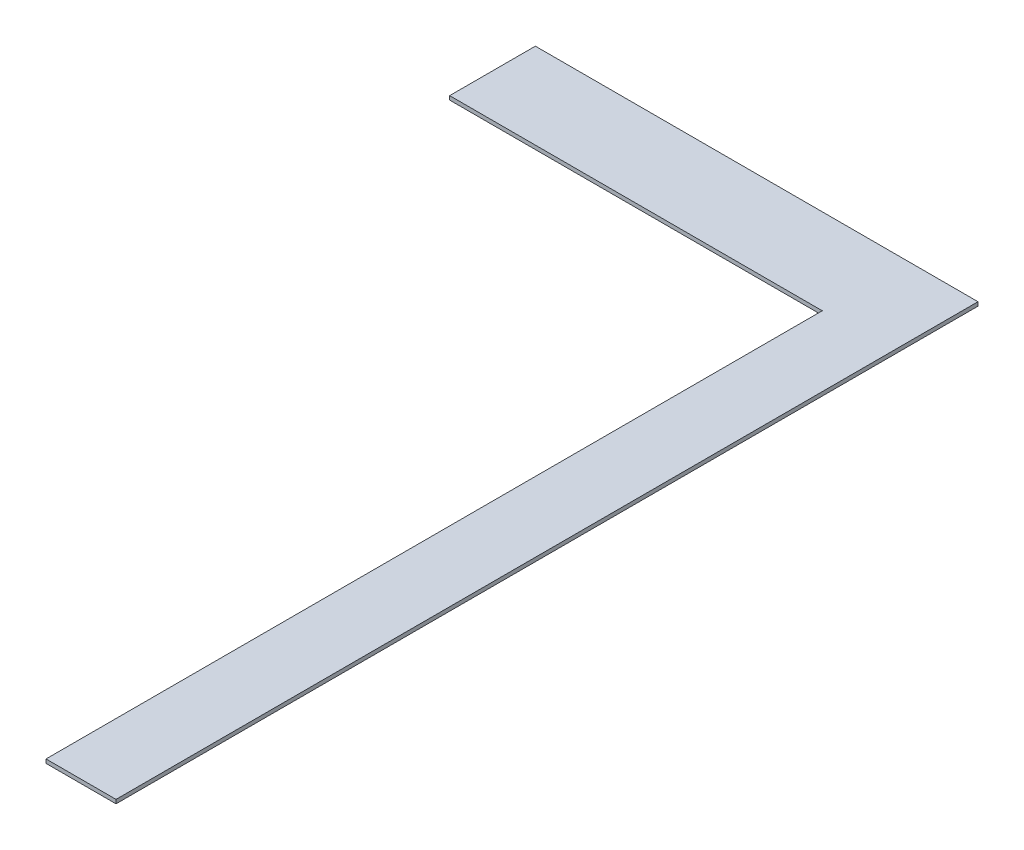
from build123d import *

# Parameters (mm, degrees)
EXTRUDE_1_DEPTH = 12.5


with BuildPart() as part:
    # Эскиз1 → Бобышка-Вытянуть1 (new body)
    with BuildSketch(Plane(origin=(0, 0, 0), x_dir=(1, 0, 0), z_dir=(0, 1, 0))):
        Polygon((-225.5, -276), (-225.5, -2776), (0, -2776), (0, 0), (-1425.5, 0), (-1425.5, -276), align=None)
    extrude(amount=-EXTRUDE_1_DEPTH)


solid = part.part
